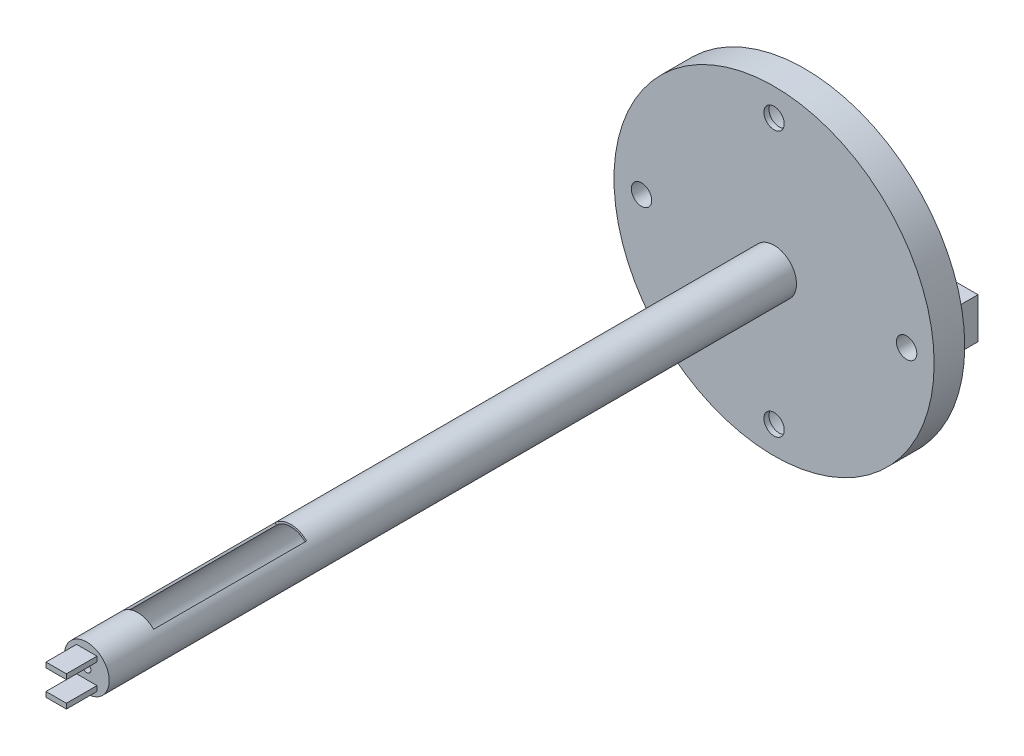
from build123d import *

# Parameters (mm, degrees)
SKETCH_1_R            = 15.7
EXTRUDE_1_DEPTH       = 3
SKETCH_5_R            = 1
CUT_EXTRUDE_3_DEPTH   = 3
SKETCH_6_R            = 1
CUT_EXTRUDE_4_DEPTH   = 3
SKETCH_7_R            = 2
CUT_EXTRUDE_5_DEPTH   = 3
SKETCH_10_W           = 12
SKETCH_10_H           = 4
EXTRUDE_8_DEPTH       = 3
SKETCH_11_W           = 12
SKETCH_11_H           = 4
EXTRUDE_9_DEPTH       = 3
SKETCH_12_R           = 2.2
EXTRUDE_11_DEPTH      = 47.4
SKETCH_16_R           = 2
CUT_EXTRUDE_6_DEPTH   = 47.4
EXTRUDE_13_DEPTH      = 15
SKETCH_20_R           = 2.2
EXTRUDE_15_DEPTH      = 8
SKETCH_22_OUTSIDE_W   = 51.074
SKETCH_22_OUTSIDE_H   = 51.074
SKETCH_22_OUTSIDE_W_2 = 2
SKETCH_22_OUTSIDE_H_2 = 0.5
CUT_EXTRUDE_7_DEPTH   = 3
SKETCH_24_R           = 0.4
CUT_EXTRUDE_9_DEPTH   = 5
SKETCH_25_R           = 1
CUT_EXTRUDE_10_DEPTH  = 0.5
SKETCH_26_R           = 2.5
CUT_EXTRUDE_12_DEPTH  = 2.5
SKETCH_27_R           = 1
CUT_EXTRUDE_13_DEPTH  = 5


with BuildPart() as part:
    # 草图1 → 凸台-拉伸1 (new body)
    with BuildSketch(Plane.XY):
        Circle(SKETCH_1_R)
    extrude(amount=EXTRUDE_1_DEPTH)

    # 草图5 → 切除-拉伸3 (cut)
    with BuildSketch(Plane(origin=(0, 0, 0), x_dir=(-1, 0, 0), z_dir=(0, 0, -1))):
        with Locations((13, 0)):
            Circle(SKETCH_5_R)
    extrude(amount=-CUT_EXTRUDE_3_DEPTH, mode=Mode.SUBTRACT)

    # 草图6 → 切除-拉伸4 (cut)
    with BuildSketch(Plane(origin=(0, 0, 0), x_dir=(-1, 0, 0), z_dir=(0, 0, -1))):
        with Locations((-13, 0)):
            Circle(SKETCH_6_R)
    extrude(amount=-CUT_EXTRUDE_4_DEPTH, mode=Mode.SUBTRACT)

    # 草图7 → 切除-拉伸5 (cut)
    with BuildSketch(Plane(origin=(0, 0, 0), x_dir=(-1, 0, 0), z_dir=(0, 0, -1))):
        Circle(SKETCH_7_R)
    extrude(amount=-CUT_EXTRUDE_5_DEPTH, mode=Mode.SUBTRACT)

    # 草图12 → 凸台-拉伸11 (add)
    with BuildSketch(Plane.XY.offset(3)):
        Circle(SKETCH_12_R)
    extrude(amount=EXTRUDE_11_DEPTH)

    # 草图16 → 切除-拉伸6 (cut)
    with BuildSketch(Plane(origin=(0, 0, 3), x_dir=(-1, 0, 0), z_dir=(0, 0, -1))):
        Circle(SKETCH_16_R)
    extrude(amount=-CUT_EXTRUDE_6_DEPTH, mode=Mode.SUBTRACT)

    # 草图19 → 凸台-拉伸13 (add)
    with BuildSketch(Plane.XY.offset(50.4)):
        with BuildLine():
            ThreePointArc((0, -2), (-1.847759065, -0.765366865), (-1.414213562, 1.414213562))
            Line((-1.414213562, 1.414213562), (-1.555634919, 1.555634919))
            ThreePointArc((-1.555634919, 1.555634919), (-2.032534972, -0.841903551), (0, -2.2))
            Line((0, -2.2), (0, -2))
        make_face()
        with BuildLine():
            Line((1.555634919, 1.555634919), (1.414213562, 1.414213562))
            ThreePointArc((1.414213562, 1.414213562), (1.847759065, 0.765366865), (2, 0))
            ThreePointArc((2, 0), (1.414213562, -1.414213562), (0, -2))
            Line((0, -2), (0, -2.2))
            ThreePointArc((0, -2.2), (1.555634919, -1.555634919), (2.2, 0))
            ThreePointArc((2.2, 0), (2.032534972, 0.841903551), (1.555634919, 1.555634919))
        make_face()
    extrude(amount=EXTRUDE_13_DEPTH)

    # 草图20 → 凸台-拉伸15 (add)
    with BuildSketch(Plane.XY.offset(65.4)):
        Circle(SKETCH_20_R)
    extrude(amount=EXTRUDE_15_DEPTH)

    # 草图22 outside → 切除-拉伸7 (cut)
    with BuildSketch(Plane.XY.offset(73.4)):
        Rectangle(SKETCH_22_OUTSIDE_W, SKETCH_22_OUTSIDE_H)
        with Locations((0, 1.25)):
            Rectangle(SKETCH_22_OUTSIDE_W_2, SKETCH_22_OUTSIDE_H_2, mode=Mode.SUBTRACT)
        with Locations((0, -1.25)):
            Rectangle(SKETCH_22_OUTSIDE_W_2, SKETCH_22_OUTSIDE_H_2, mode=Mode.SUBTRACT)
    extrude(amount=-CUT_EXTRUDE_7_DEPTH, mode=Mode.SUBTRACT)

    # 草图24 → 切除-拉伸9 (cut)
    with BuildSketch(Plane.XY.offset(70.4)):
        Circle(SKETCH_24_R)
    extrude(amount=-CUT_EXTRUDE_9_DEPTH, mode=Mode.SUBTRACT)

    # 草图25 → 切除-拉伸10 (cut)
    with BuildSketch(Plane.XY.offset(3)):
        with Locations((0, 13)):
            Circle(SKETCH_25_R)
        with Locations((0, -13)):
            Circle(SKETCH_25_R)
    extrude(amount=-CUT_EXTRUDE_10_DEPTH, mode=Mode.SUBTRACT)

    # 草图26 → 切除-拉伸12 (cut)
    with BuildSketch(Plane.XY.offset(2.5)):
        with Locations((0, 13)):
            Circle(SKETCH_26_R)
        with Locations((0, -13)):
            Circle(SKETCH_26_R)
    extrude(amount=-CUT_EXTRUDE_12_DEPTH, mode=Mode.SUBTRACT)


with BuildPart() as body_2:
    # 草图10 → 凸台-拉伸8 (new body)
    with BuildSketch(Plane(origin=(0, 0, 0), x_dir=(-1, 0, 0), z_dir=(0, 0, -1))):
        with Locations((-8, 0)):
            Rectangle(SKETCH_10_W, SKETCH_10_H)
    extrude(amount=EXTRUDE_8_DEPTH)


with BuildPart() as body_3:
    # 草图11 → 凸台-拉伸9 (new body)
    with BuildSketch(Plane(origin=(0, 0, 0), x_dir=(-1, 0, 0), z_dir=(0, 0, -1))):
        with Locations((8, 0)):
            Rectangle(SKETCH_11_W, SKETCH_11_H)
    extrude(amount=EXTRUDE_9_DEPTH)


with BuildPart() as cut_extrude_13_tool:
    # 草图27 → 切除-拉伸13 (new body)
    with BuildSketch(Plane(origin=(0, 0, -3), x_dir=(-1, 0, 0), z_dir=(0, 0, -1))):
        with Locations((8, 0)):
            Circle(SKETCH_27_R)
        with Locations((-8, 0)):
            Circle(SKETCH_27_R)
    extrude(amount=-CUT_EXTRUDE_13_DEPTH)


with BuildPart() as part_1:
    add(part.part)

    # 切除-拉伸13: cut by cut_extrude_13_tool
    add(cut_extrude_13_tool.part, mode=Mode.SUBTRACT)


with BuildPart() as body_2_1:
    add(body_2.part)

    # 切除-拉伸13: cut by cut_extrude_13_tool
    add(cut_extrude_13_tool.part, mode=Mode.SUBTRACT)


with BuildPart() as body_3_1:
    add(body_3.part)

    # 切除-拉伸13: cut by cut_extrude_13_tool
    add(cut_extrude_13_tool.part, mode=Mode.SUBTRACT)


solid = Compound([part_1.part, body_2_1.part, body_3_1.part])
